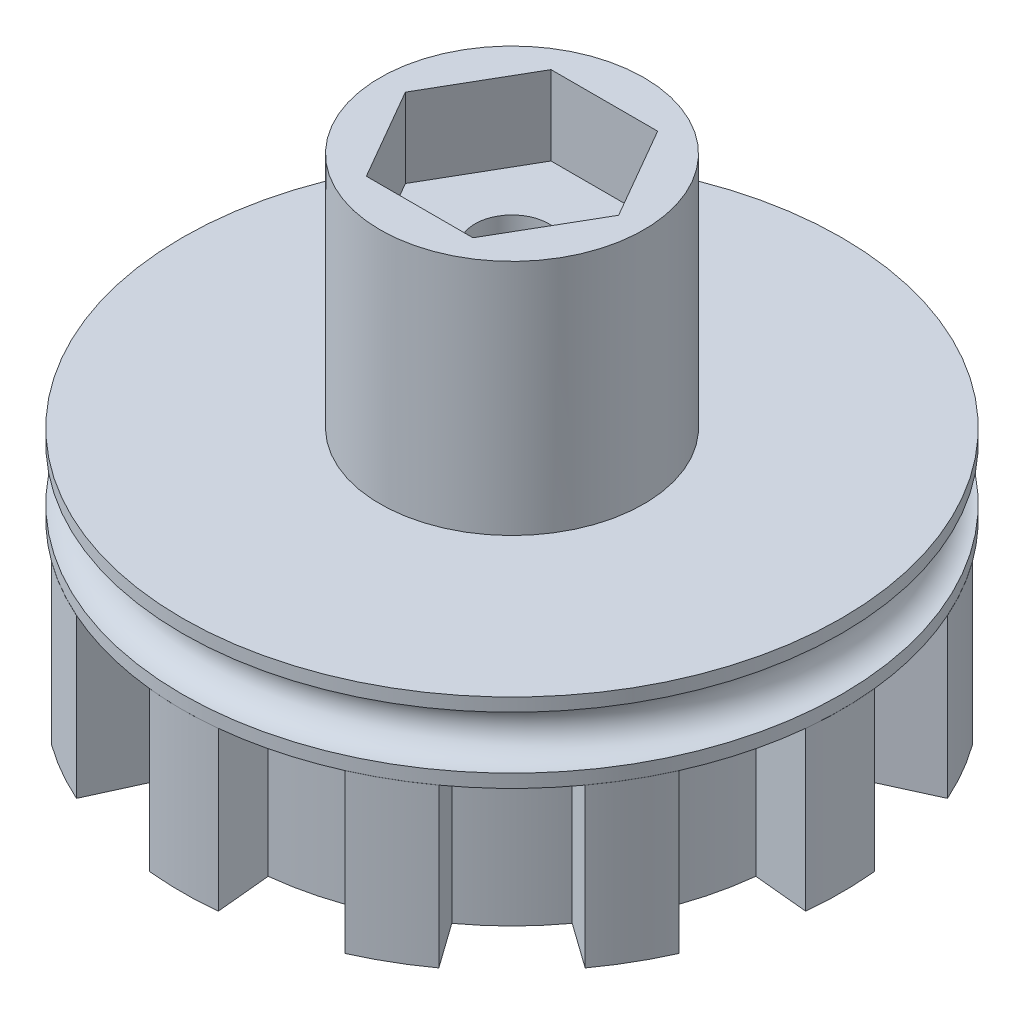
from build123d import *

# Parameters (mm, degrees)
EXTRUDE_1_DEPTH     = 6
SKETCH_3_R          = 1.4
CUT_EXTRUDE_1_DEPTH = 6
SKETCH_4_R          = 5
EXTRUDE_2_DEPTH     = 12
CUT_EXTRUDE_2_DEPTH = 12
SKETCH_6_R          = 1.5
CUT_EXTRUDE_3_DEPTH = 31
SKETCH_7_R          = 1.5
SKETCH_7_R_2        = 1.4
EXTRUDE_3_DEPTH     = 18
CUT_EXTRUDE_4_DEPTH = 3


with BuildPart() as part:
    # 草图2 → 凸台-拉伸1 (new body)
    with BuildSketch(Plane(origin=(0, 0, 0), x_dir=(1, 0, 0), z_dir=(0, 1, 0))):
        with BuildLine():
            Line((-1.1, 10.341663309), (-1.3, 12.432216214))
            ThreePointArc((-1.3, 12.432216214), (0, 12.5), (1.3, 12.432216214))
            Line((1.3, 12.432216214), (1.1, 10.341663309))
            ThreePointArc((1.1, 10.341663309), (2.691718069, 10.045628593), (4.21820371, 9.506143143))
            Line((4.21820371, 9.506143143), (5.090275082, 11.416615067))
            ThreePointArc((5.090275082, 11.416615067), (6.25, 10.825317547), (7.341941132, 10.116615067))
            Line((7.341941132, 10.116615067), (6.123459599, 8.406143143))
            ThreePointArc((6.123459599, 8.406143143), (7.353910524, 7.353910524), (8.406143143, 6.123459599))
            Line((8.406143143, 6.123459599), (10.116615067, 7.341941132))
            ThreePointArc((10.116615067, 7.341941132), (10.825317547, 6.25), (11.416615067, 5.090275082))
            Line((11.416615067, 5.090275082), (9.506143143, 4.21820371))
            ThreePointArc((9.506143143, 4.21820371), (10.045628593, 2.691718069), (10.341663309, 1.1))
            Line((10.341663309, 1.1), (12.432216214, 1.3))
            ThreePointArc((12.432216214, 1.3), (12.5, 0), (12.432216214, -1.3))
            Line((12.432216214, -1.3), (10.341663309, -1.1))
            ThreePointArc((10.341663309, -1.1), (10.045628593, -2.691718069), (9.506143143, -4.21820371))
            Line((9.506143143, -4.21820371), (11.416615067, -5.090275082))
            ThreePointArc((11.416615067, -5.090275082), (10.825317547, -6.25), (10.116615067, -7.341941132))
            Line((10.116615067, -7.341941132), (8.406143143, -6.123459599))
            ThreePointArc((8.406143143, -6.123459599), (7.353910524, -7.353910524), (6.123459599, -8.406143143))
            Line((6.123459599, -8.406143143), (7.341941132, -10.116615067))
            ThreePointArc((7.341941132, -10.116615067), (6.25, -10.825317547), (5.090275082, -11.416615067))
            Line((5.090275082, -11.416615067), (4.21820371, -9.506143143))
            ThreePointArc((4.21820371, -9.506143143), (2.691718069, -10.045628593), (1.1, -10.341663309))
            Line((1.1, -10.341663309), (1.3, -12.432216214))
            ThreePointArc((1.3, -12.432216214), (0, -12.5), (-1.3, -12.432216214))
            Line((-1.3, -12.432216214), (-1.1, -10.341663309))
            ThreePointArc((-1.1, -10.341663309), (-2.691718069, -10.045628593), (-4.21820371, -9.506143143))
            Line((-4.21820371, -9.506143143), (-5.090275082, -11.416615067))
            ThreePointArc((-5.090275082, -11.416615067), (-6.25, -10.825317547), (-7.341941132, -10.116615067))
            Line((-7.341941132, -10.116615067), (-6.123459599, -8.406143143))
            ThreePointArc((-6.123459599, -8.406143143), (-7.353910524, -7.353910524), (-8.406143143, -6.123459599))
            Line((-8.406143143, -6.123459599), (-10.116615067, -7.341941132))
            ThreePointArc((-10.116615067, -7.341941132), (-10.825317547, -6.25), (-11.416615067, -5.090275082))
            Line((-11.416615067, -5.090275082), (-9.506143143, -4.21820371))
            ThreePointArc((-9.506143143, -4.21820371), (-10.045628593, -2.691718069), (-10.341663309, -1.1))
            Line((-10.341663309, -1.1), (-12.432216214, -1.3))
            ThreePointArc((-12.432216214, -1.3), (-12.5, 0), (-12.432216214, 1.3))
            Line((-12.432216214, 1.3), (-10.341663309, 1.1))
            ThreePointArc((-10.341663309, 1.1), (-10.045628593, 2.691718069), (-9.506143143, 4.21820371))
            Line((-9.506143143, 4.21820371), (-11.416615067, 5.090275082))
            ThreePointArc((-11.416615067, 5.090275082), (-10.825317547, 6.25), (-10.116615067, 7.341941132))
            Line((-10.116615067, 7.341941132), (-8.406143143, 6.123459599))
            ThreePointArc((-8.406143143, 6.123459599), (-7.353910524, 7.353910524), (-6.123459599, 8.406143143))
            Line((-6.123459599, 8.406143143), (-7.341941132, 10.116615067))
            ThreePointArc((-7.341941132, 10.116615067), (-6.25, 10.825317547), (-5.090275082, 11.416615067))
            Line((-5.090275082, 11.416615067), (-4.21820371, 9.506143143))
            ThreePointArc((-4.21820371, 9.506143143), (-2.691718069, 10.045628593), (-1.1, 10.341663309))
        make_face()
    extrude(amount=EXTRUDE_1_DEPTH)

    # 草图3 → 切除-拉伸1 (cut)
    with BuildSketch(Plane(origin=(0, 6, 0), x_dir=(1, 0, 0), z_dir=(0, 1, 0))):
        with Locations(Location((0, 0, 0), (0, 0, 270))):
            Circle(SKETCH_3_R)
    extrude(amount=-CUT_EXTRUDE_1_DEPTH, mode=Mode.SUBTRACT)

    # 草图4 → 凸台-拉伸2 (add)
    with BuildSketch(Plane(origin=(0, 6, 0), x_dir=(1, 0, 0), z_dir=(0, 1, 0))):
        with Locations(Location((0, 0, 0), (0, 0, 270))):
            Circle(SKETCH_4_R)
    extrude(amount=EXTRUDE_2_DEPTH)

    # 草图5 → 切除-拉伸2 (cut)
    with BuildSketch(Plane(origin=(0, 18, 0), x_dir=(1, 0, 0), z_dir=(0, 1, 0))):
        with BuildLine():
            Line((-1, -1.118033989), (1, -1.118033989))
            ThreePointArc((1, -1.118033989), (0, 1.5), (-1, -1.118033989))
        make_face()
    extrude(amount=-CUT_EXTRUDE_2_DEPTH, mode=Mode.SUBTRACT)

    # 草图6 → 切除-拉伸3 (cut)
    with BuildSketch(Plane(origin=(0, 18, 0), x_dir=(1, 0, 0), z_dir=(0, 1, 0))):
        with Locations(Location((0, 0, 0), (0, 0, 270))):
            Circle(SKETCH_6_R)
    extrude(amount=-CUT_EXTRUDE_3_DEPTH, mode=Mode.SUBTRACT)

    # 草图7 → 凸台-拉伸3 (add)
    with BuildSketch(Plane(origin=(0, 18, 0), x_dir=(1, 0, 0), z_dir=(0, 1, 0))):
        Circle(SKETCH_7_R)
        with Locations(Location((0, 0, 0), (0, 0, 270))):
            Circle(SKETCH_7_R_2, mode=Mode.SUBTRACT)
    extrude(amount=-EXTRUDE_3_DEPTH)

    # 草图8 → 切除-拉伸4 (cut)
    with BuildSketch(Plane(origin=(0, 18, 0), x_dir=(1, 0, 0), z_dir=(0, 1, 0))):
        Polygon((4.041451884, 0), (2.020725942, 3.5), (-2.020725942, 3.5), (-4.041451884, 0), (-2.020725942, -3.5), (2.020725942, -3.5), align=None)
    extrude(amount=-CUT_EXTRUDE_4_DEPTH, mode=Mode.SUBTRACT)

    # 草图9 → 旋转1 (revolve)
    with BuildSketch(Plane(origin=(0, 0, 0), x_dir=(0, 0, -1), z_dir=(1, 0, 0)), mode=Mode.PRIVATE) as revolve_1_sk:
        with BuildLine():
            Line((5, 6), (12.496216833, 6))
            Line((12.496216833, 6), (12.496216833, 6.5))
            ThreePointArc((12.496216833, 6.5), (11.496216833, 7.5), (12.496216833, 8.5))
            Line((12.496216833, 8.5), (12.496216833, 9))
            Line((12.496216833, 9), (5, 9))
            Line((5, 9), (5, 6))
        make_face()
    revolve(revolve_1_sk.sketch.rotate(Axis((0, 17.668891616, 0), (0, -1, 0)), 180), axis=Axis((0, 17.668891616, 0), (0, -1, 0)))


solid = part.part
